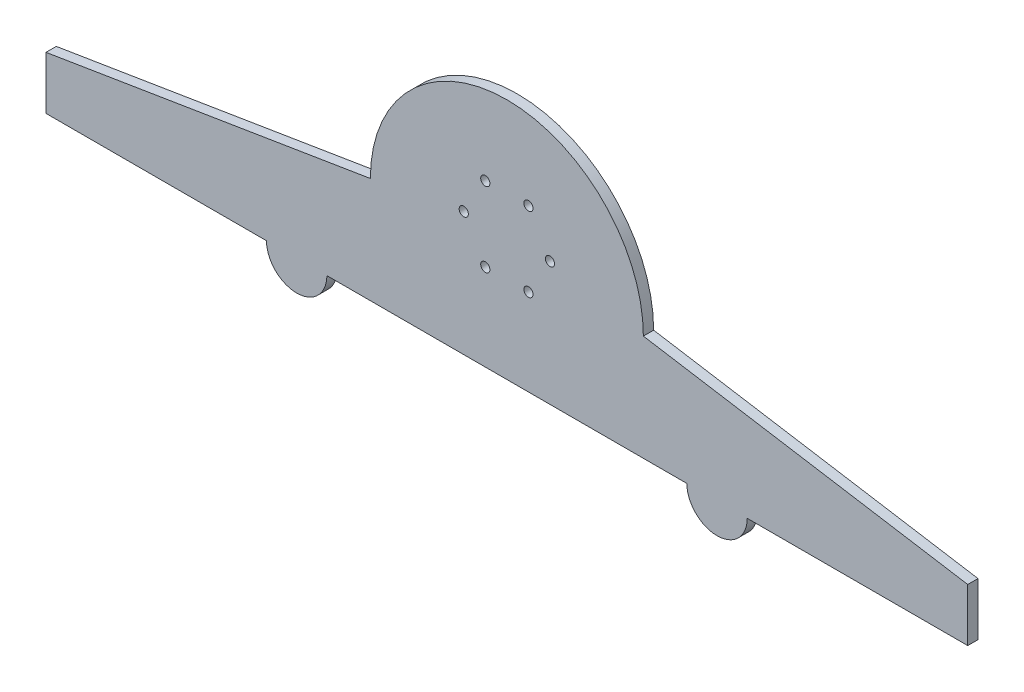
from build123d import *

# Parameters (mm, degrees)
SKETCH1_R           = 1.7
BOSS_EXTRUDE1_DEPTH = 3.8


with BuildPart() as part:
    # Sketch1 → Boss-Extrude1 (new body)
    with BuildSketch(Plane.XY):
        with BuildLine():
            Line((-170.500000005, 25.75), (-88.925688775, 25.75))
            ThreePointArc((-88.925688775, 25.75), (-77.757832362, 14.582143587), (-66.589975949, 25.75))
            Line((-66.589975949, 25.75), (66.589975949, 25.75))
            ThreePointArc((66.589975949, 25.75), (77.757832362, 14.582143587), (88.925688775, 25.75))
            Line((88.925688775, 25.75), (170.500000005, 25.75))
            Line((170.500000005, 25.75), (170.500000005, 45.331584009))
            Line((170.500000005, 45.331584009), (50.500000005, 64.913168018))
            ThreePointArc((50.500000005, 64.913168018), (0, 115.413168023), (-50.500000005, 64.913168018))
            Line((-50.500000005, 64.913168018), (-170.500000005, 45.331584009))
            Line((-170.500000005, 45.331584009), (-170.500000005, 25.75))
        make_face()
        with Locations(Location((15.95, 71.613168018, 0), (0, 0, 180))):
            Circle(SKETCH1_R, mode=Mode.SUBTRACT)
        with Locations(Location((7.975, 57.800062828, 0), (0, 0, 180))):
            Circle(SKETCH1_R, mode=Mode.SUBTRACT)
        with Locations(Location((-7.975, 57.800062828, 0), (0, 0, 180))):
            Circle(SKETCH1_R, mode=Mode.SUBTRACT)
        with Locations(Location((-15.95, 71.613168018, 0), (0, 0, 180))):
            Circle(SKETCH1_R, mode=Mode.SUBTRACT)
        with Locations(Location((7.975, 85.426273209, 0), (0, 0, 180))):
            Circle(SKETCH1_R, mode=Mode.SUBTRACT)
        with Locations(Location((-7.975, 85.426273209, 0), (0, 0, 180))):
            Circle(SKETCH1_R, mode=Mode.SUBTRACT)
    extrude(amount=BOSS_EXTRUDE1_DEPTH)


solid = part.part
